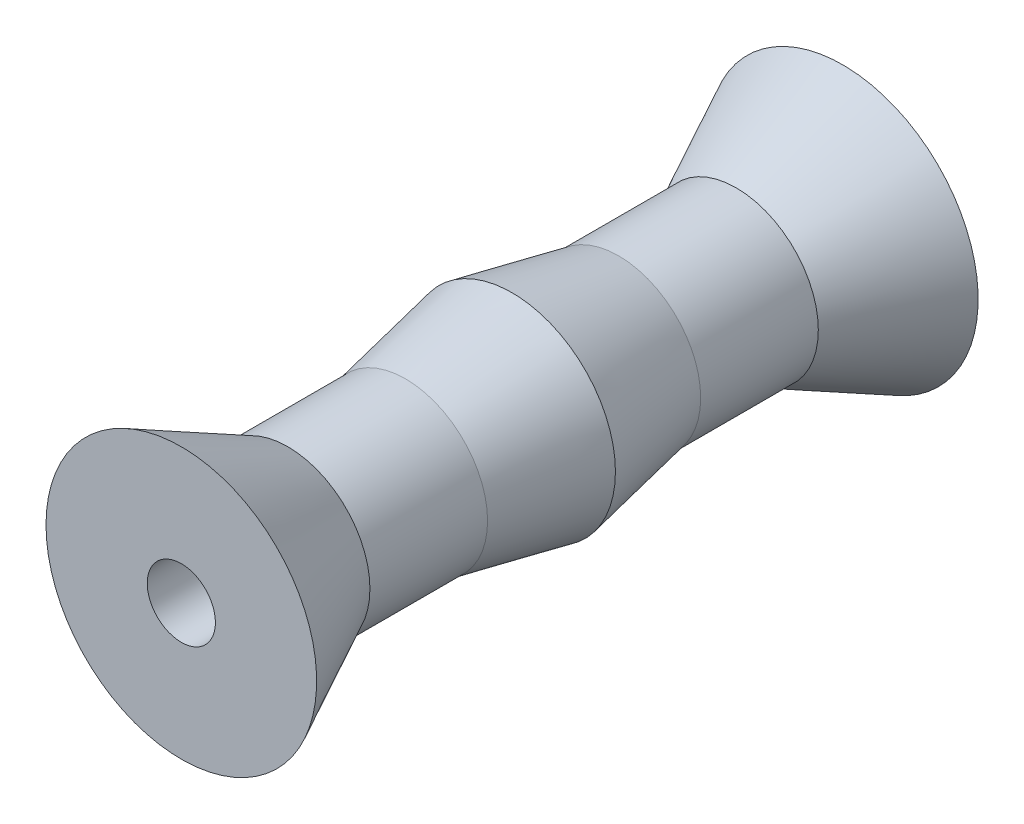
from build123d import *

# Parameters (mm, degrees)
ESQUISSE1_R        = 4.8895
ESQUISSE1_R_2      = 2.032
BOSS_EXTRU_1_DEPTH = 19.71


with BuildPart() as part:
    # Esquisse1 → Boss.-Extru.1 (new, symmetric)
    with BuildSketch(Plane.XY):
        Circle(ESQUISSE1_R)
        Circle(ESQUISSE1_R_2, mode=Mode.SUBTRACT)
    extrude(amount=BOSS_EXTRU_1_DEPTH, both=True)

    # Esquisse2 → Révolution1 (revolve)
    with BuildSketch(Plane(origin=(0, 0, 0), x_dir=(0, 0, -1), z_dir=(1, 0, 0)), mode=Mode.PRIVATE) as r_volution1_sk:
        Polygon((-13.36, 4.8895), (-19.71, 8.0645), (-19.71, 4.8895), align=None)
        Polygon((0, 6.1595), (-6.35, 4.8895), (0, 4.8895), (6.35, 4.8895), align=None)
        Polygon((19.71, 4.8895), (19.71, 8.0645), (13.36, 4.8895), align=None)
    revolve(r_volution1_sk.sketch.rotate(Axis((0, 0, 0), (0, 0, 1)), 90), axis=Axis((0, 0, 0), (0, 0, 1)))


solid = part.part
